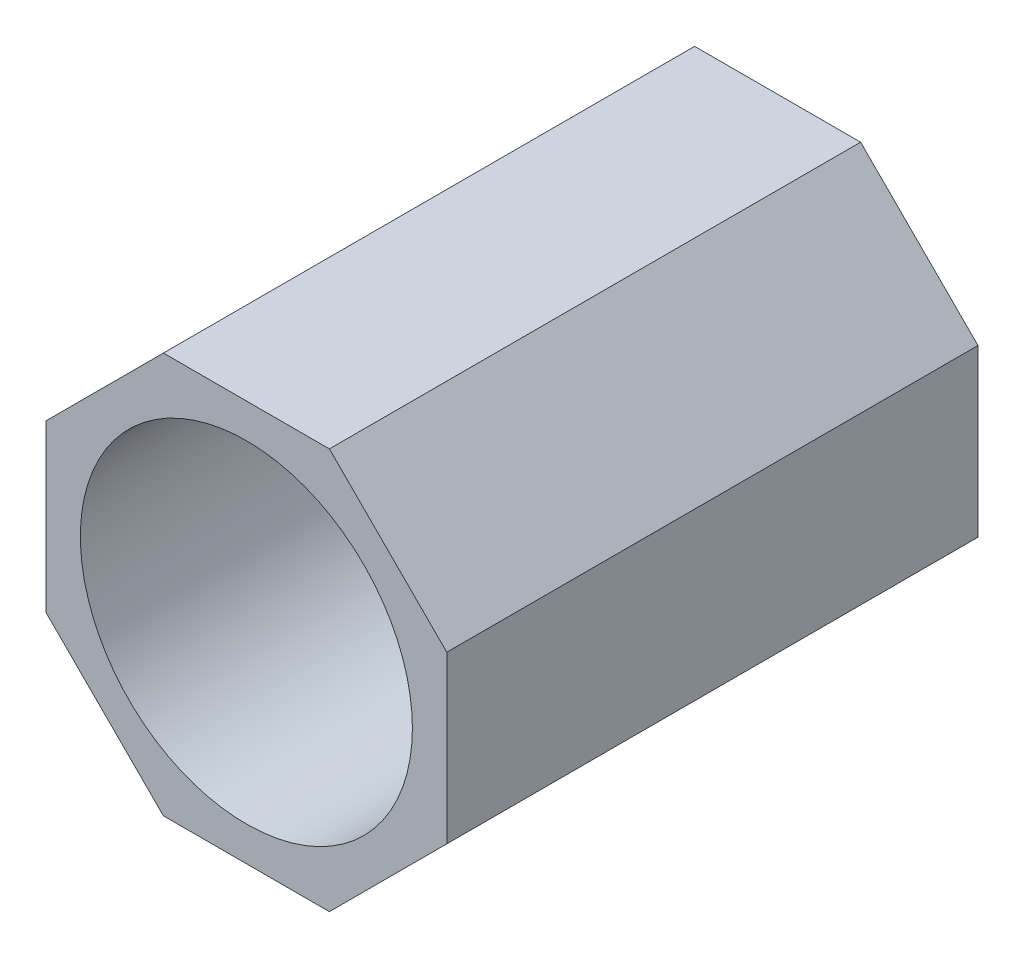
from build123d import *

# Parameters (mm, degrees)
SKETCH1_R           = 2.5
BOSS_EXTRUDE1_DEPTH = 8


with BuildPart() as part:
    # Sketch1 → Boss-Extrude1 (new body)
    with BuildSketch(Plane.XY):
        Polygon((-1.25, 3.017766953), (1.25, 3.017766953), (3.017766953, 1.25), (3.017766953, -1.25), (1.25, -3.017766953), (-1.25, -3.017766953), (-3.017766953, -1.25), (-3.017766953, 1.25), align=None)
        Circle(SKETCH1_R, mode=Mode.SUBTRACT)
    extrude(amount=BOSS_EXTRUDE1_DEPTH)


solid = part.part
